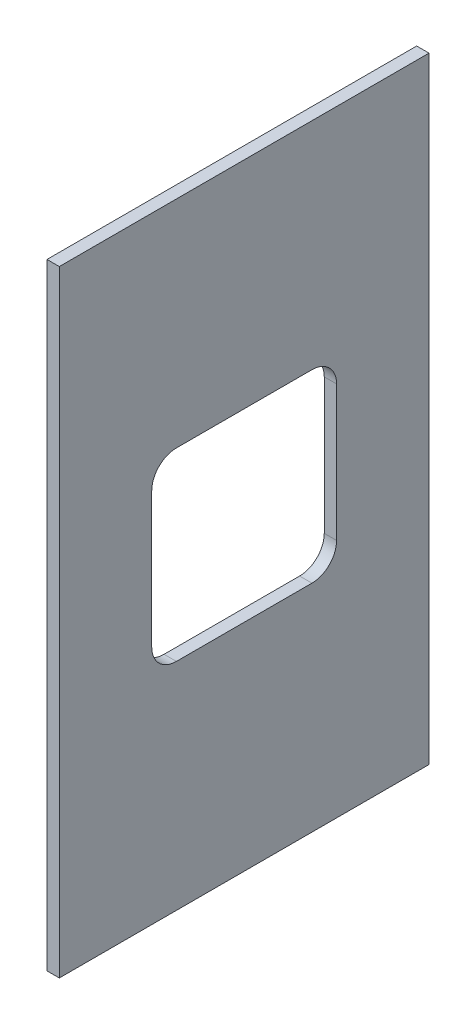
from build123d import *

# Parameters (mm, degrees)
SKETCH1_W           = 500
SKETCH1_H           = 300
BOSS_EXTRUDE1_DEPTH = 10


with BuildPart() as part:
    # Sketch1 → Boss-Extrude1 (new body)
    with BuildSketch(Plane.YZ):
        with Locations((250, 150)):
            Rectangle(SKETCH1_W, SKETCH1_H)
        with BuildLine():
            Line((195, 75), (305, 75))
            ThreePointArc((305, 75), (319.142135624, 80.857864376), (325, 95))
            Line((325, 95), (325, 205))
            ThreePointArc((325, 205), (319.142135624, 219.142135624), (305, 225))
            Line((305, 225), (195, 225))
            ThreePointArc((195, 225), (180.857864376, 219.142135624), (175, 205))
            Line((175, 205), (175, 95))
            ThreePointArc((175, 95), (180.857864376, 80.857864376), (195, 75))
        make_face(mode=Mode.SUBTRACT)
    extrude(amount=BOSS_EXTRUDE1_DEPTH)


solid = part.part
